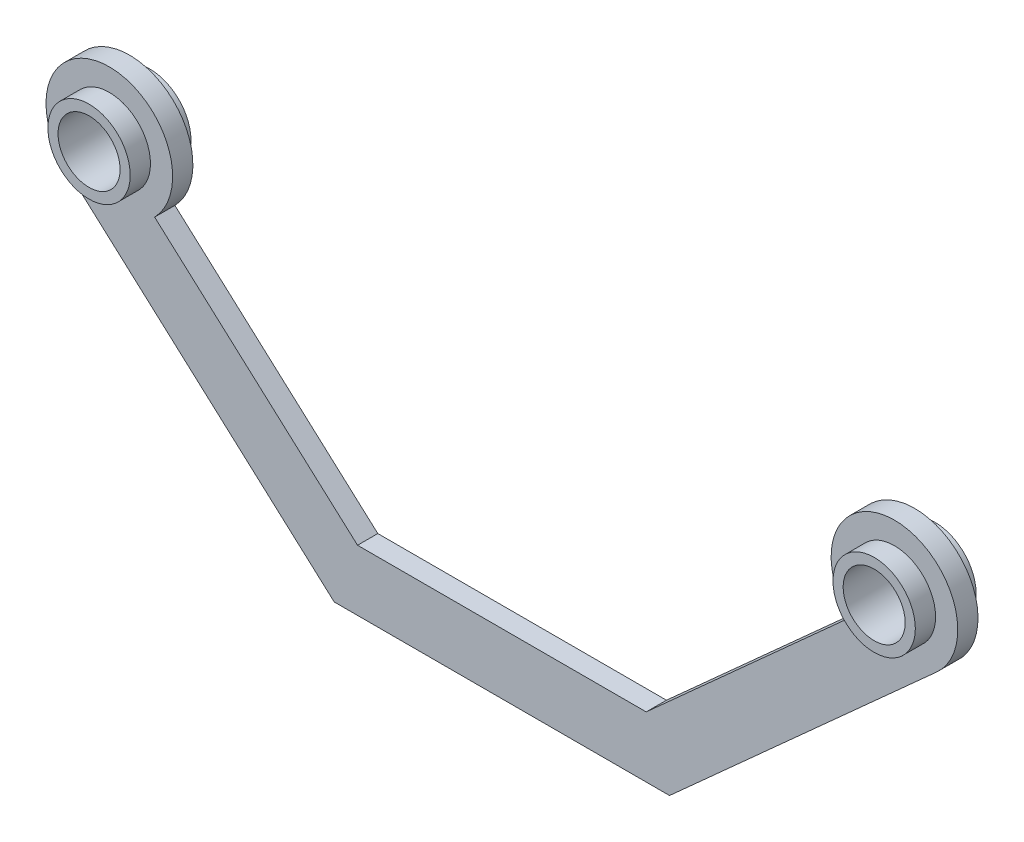
from build123d import *

# Parameters (mm, degrees)
SKETCH1_R           = 6.25
BOSS_EXTRUDE1_DEPTH = 4
BOSS_EXTRUDE5_START = -8
SKETCH7_R           = 8.125
SKETCH7_R_2         = 6.125
BOSS_EXTRUDE5_DEPTH = 12


with BuildPart() as part:
    # Sketch1 → Boss-Extrude1 (new body)
    with BuildSketch(Plane.XY):
        with BuildLine():
            Line((85.864132579, -9.289310318), (33.098166031, -56.8))
            Line((33.098166031, -56.8), (-33.098166031, -56.8))
            Line((-33.098166031, -56.8), (-85.864132579, -9.289310318))
            ThreePointArc((-85.864132579, -9.289310318), (-77.904361198, 12.493457969), (-68.552689408, -8.729011007))
            Line((-68.552689408, -8.729011007), (-28.491797611, -44.8))
            Line((-28.491797611, -44.8), (28.491797611, -44.8))
            Line((28.491797611, -44.8), (68.552689408, -8.729011007))
            ThreePointArc((68.552689408, -8.729011007), (77.904361198, 12.493457969), (85.864132579, -9.289310318))
        make_face()
        with Locations((-77.5, 0)):
            Circle(SKETCH1_R, mode=Mode.SUBTRACT)
        with Locations((77.5, 0)):
            Circle(SKETCH1_R, mode=Mode.SUBTRACT)
    extrude(amount=BOSS_EXTRUDE1_DEPTH)

    # Sketch7 → Boss-Extrude5 (add)
    with BuildSketch(Plane.XY.offset(4).offset(BOSS_EXTRUDE5_START)):
        with Locations((-77.5, 0)):
            Circle(SKETCH7_R)
        with Locations((-77.5, 0)):
            Circle(SKETCH7_R_2, mode=Mode.SUBTRACT)
    boss_extrude5 = extrude(amount=BOSS_EXTRUDE5_DEPTH)

    # Mirror1: Boss-Extrude5 across plane
    add(boss_extrude5.mirror(Plane(origin=(0, 0, 0), x_dir=(0, 0, 1), z_dir=(1, 0, 0))))


solid = part.part
